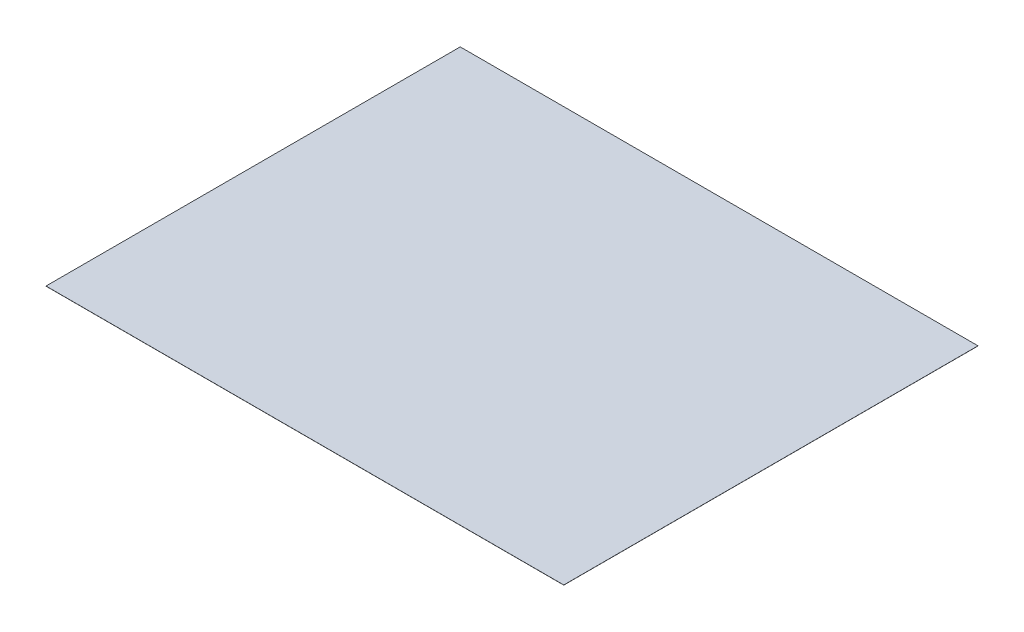
from build123d import *

# Parameters (mm, degrees)
SKETCH1_W           = 6096
SKETCH1_H           = 4876.8
BOSS_EXTRUDE1_DEPTH = 1.5875


with BuildPart() as part:
    # Sketch1 → Boss-Extrude1 (new body)
    with BuildSketch(Plane(origin=(0, 0, 0), x_dir=(1, 0, 0), z_dir=(0, 1, 0))):
        Rectangle(SKETCH1_W, SKETCH1_H)
    extrude(amount=BOSS_EXTRUDE1_DEPTH)


solid = part.part
